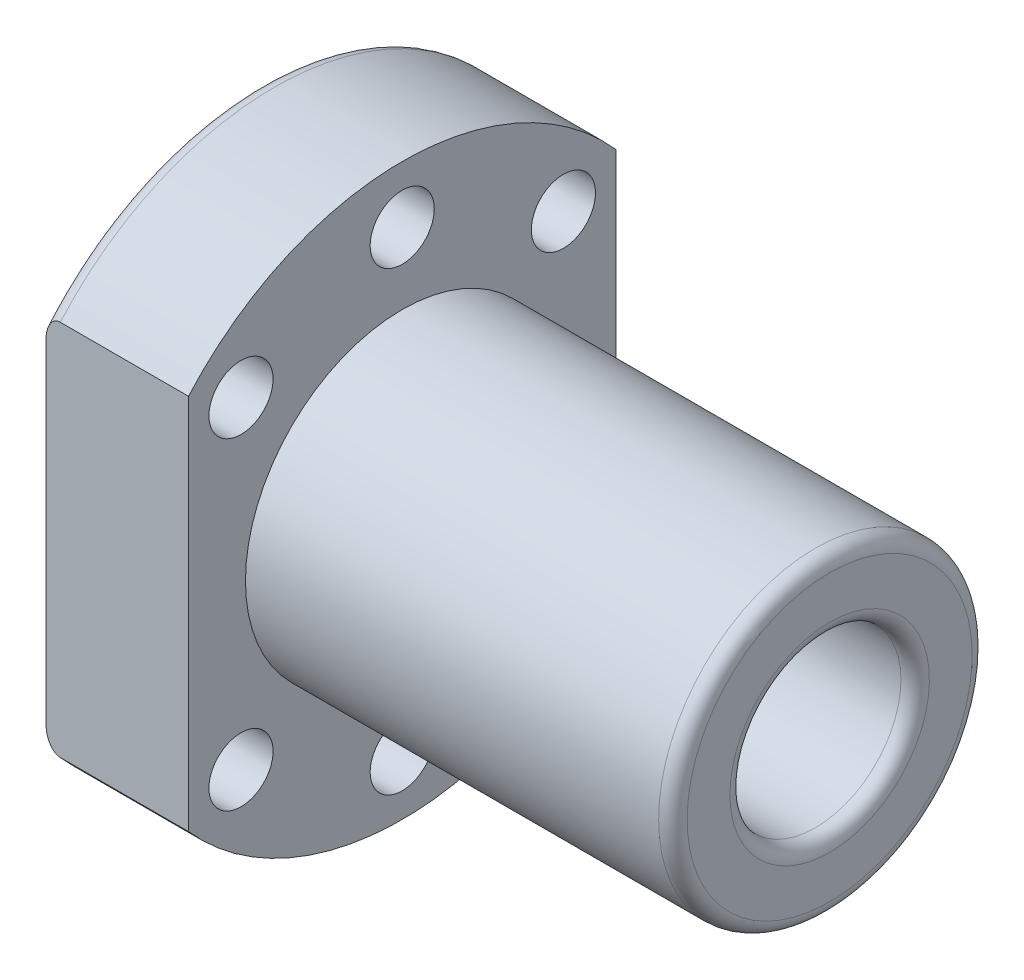
from build123d import *

# Parameters (mm, degrees)
SKETCH_2_R           = 6
CUT_EXTRUDE_1_DEPTH  = 49.989794856
SKETCH_3_R           = 2.25
CUT_EXTRUDE_2_DEPTH  = 49.989794856
SKETCH_4_OUTSIDE_W   = 55.856
SKETCH_4_OUTSIDE_H   = 55.856
SKETCH_4_OUTSIDE_W_2 = 30
SKETCH_4_OUTSIDE_H_2 = 50.828583192
CUT_EXTRUDE_3_DEPTH  = 10
FILLET_1_R           = 1


with BuildPart() as part:
    # 草图1 → 旋转1 (revolve)
    with BuildSketch(Plane.XY):
        Polygon((0, 0), (0, 20), (10, 20), (10, 11), (40, 11), (40, 0), align=None)
    revolve(axis=Axis((40, 0, 0), (-1, 0, 0)))

    # 草图2 → 切除-拉伸1 (cut, through all)
    with BuildSketch(Plane.ZY):
        with Locations(Location((0, 0, 0), (0, 0, 270))):
            Circle(SKETCH_2_R)
    extrude(amount=-CUT_EXTRUDE_1_DEPTH, mode=Mode.SUBTRACT)

    # 草图3 → 切除-拉伸2 (cut, through all)
    with BuildSketch(Plane.ZY):
        with Locations(Location((0, 16, 0), (0, 0, 270))):
            Circle(SKETCH_3_R)
        with Locations(Location((11.313708499, 11.313708499, 0), (0, 0, 270))):
            Circle(SKETCH_3_R)
        with Locations(Location((11.313708499, -11.313708499, 0), (0, 0, 270))):
            Circle(SKETCH_3_R)
        with Locations(Location((0, -16, 0), (0, 0, 270))):
            Circle(SKETCH_3_R)
        with Locations(Location((-11.313708499, -11.313708499, 0), (0, 0, 270))):
            Circle(SKETCH_3_R)
        with Locations(Location((-11.313708499, 11.313708499, 0), (0, 0, 270))):
            Circle(SKETCH_3_R)
    extrude(amount=-CUT_EXTRUDE_2_DEPTH, mode=Mode.SUBTRACT)

    # 草图4 outside → 切除-拉伸3 (cut)
    with BuildSketch(Plane.ZY):
        Rectangle(SKETCH_4_OUTSIDE_W, SKETCH_4_OUTSIDE_H)
        Rectangle(SKETCH_4_OUTSIDE_W_2, SKETCH_4_OUTSIDE_H_2, mode=Mode.SUBTRACT)
    extrude(amount=-CUT_EXTRUDE_3_DEPTH, mode=Mode.SUBTRACT)

    # 圆角1
    fillet_1_edges = [part.edges().sort_by_distance(p)[0] for p in [
        (40, 6, 0),
        (0, 6, 0),
        (0, -20, 0),
        (0, 20, 0),
        (40, -11, 0),
    ]]
    fillet(fillet_1_edges, radius=FILLET_1_R)


solid = part.part
